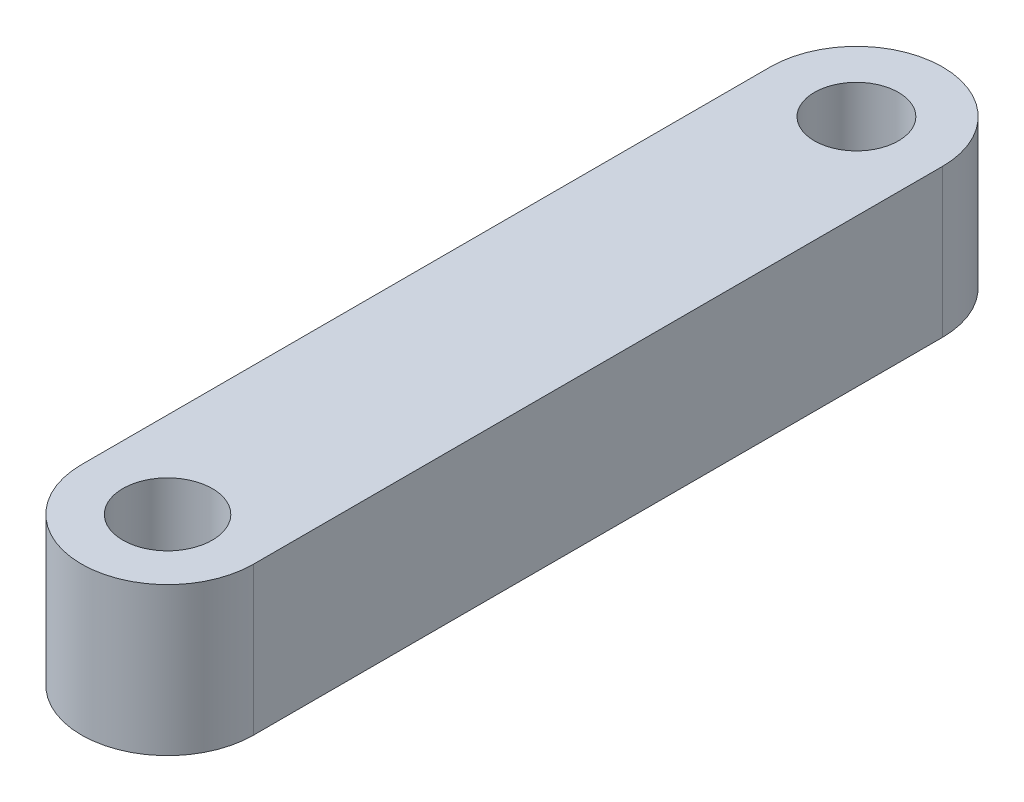
from build123d import *

# Parameters (mm, degrees)
BOSS_EXTRUDE1_DEPTH              = 5.461
M3_CLEARANCE_HOLE_CLEARANCE_D    = 3.3
M3_CLEARANCE_HOLE_INTERFERENCE_D = 3.1


with BuildPart() as part:
    # Sketch1 → Boss-Extrude1 (new body)
    with BuildSketch(Plane(origin=(0, 0, 0), x_dir=(1, 0, 0), z_dir=(0, 1, 0))):
        with BuildLine():
            Line((-3.175, -12.7), (-3.175, 12.7))
            ThreePointArc((-3.175, 12.7), (0, 15.875), (3.175, 12.7))
            Line((3.175, 12.7), (3.175, -12.7))
            ThreePointArc((3.175, -12.7), (0, -15.875), (-3.175, -12.7))
        make_face()
    extrude(amount=BOSS_EXTRUDE1_DEPTH)

    # M3 Clearance Hole clearance (through all)
    with Locations(Plane(origin=(0, 5.461, 0), x_dir=(1, 0, 0), z_dir=(0, 1, 0))):
        with Locations((0, -12.7)):
            Hole(M3_CLEARANCE_HOLE_CLEARANCE_D / 2)

    # M3 Clearance Hole interference (through all)
    with Locations(Plane(origin=(0, 5.461, 0), x_dir=(1, 0, 0), z_dir=(0, 1, 0))):
        with Locations((0, 12.7)):
            Hole(M3_CLEARANCE_HOLE_INTERFERENCE_D / 2)


solid = part.part
